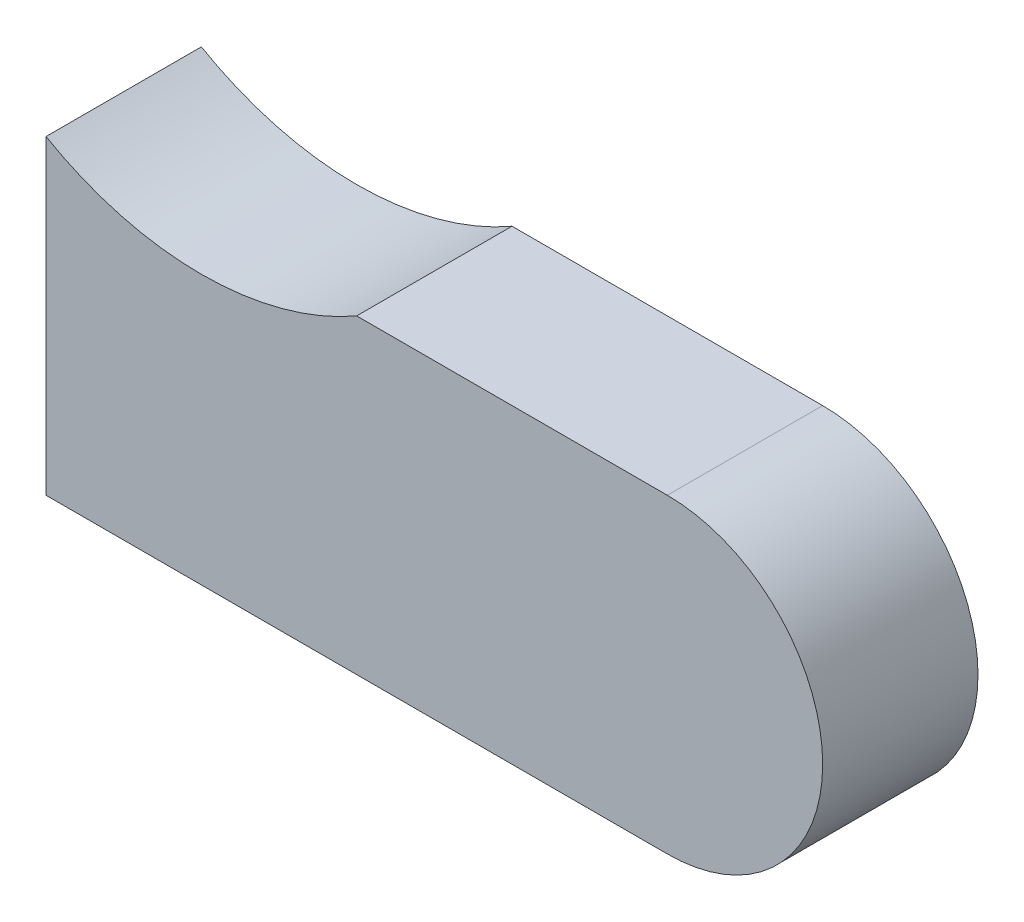
from build123d import *

# Parameters (mm, degrees)
BOSS_EXTRUDE1_DEPTH = 5


with BuildPart() as part:
    # Sketch1 → Boss-Extrude1 (new body)
    with BuildSketch(Plane.XY):
        with BuildLine():
            Line((0, 0), (20, 0))
            ThreePointArc((20, 0), (25, 5), (20, 10))
            Line((20, 10), (10, 10))
            ThreePointArc((10, 10), (5, 8.660254038), (0, 10))
            Line((0, 10), (0, 0))
        make_face()
    extrude(amount=BOSS_EXTRUDE1_DEPTH)


solid = part.part
